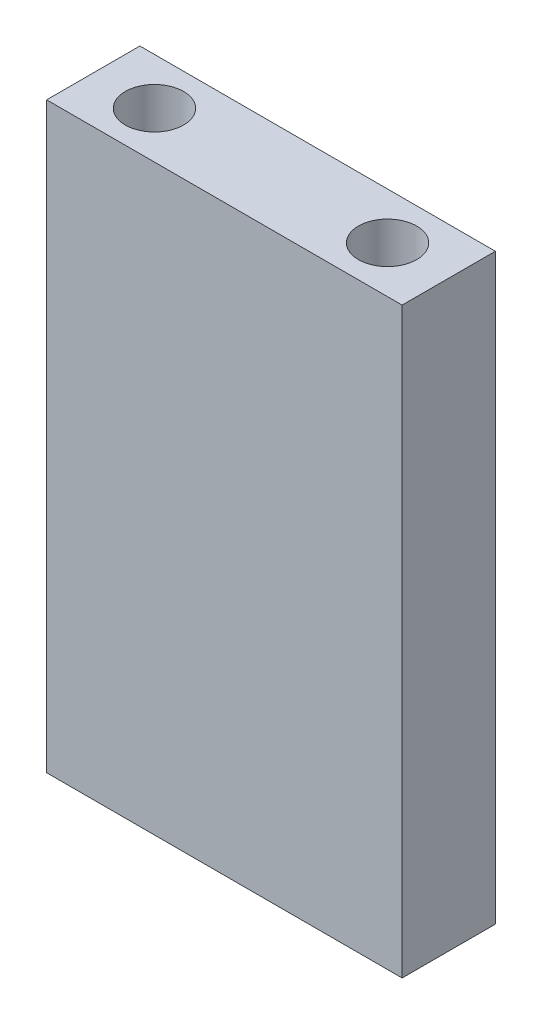
from build123d import *

# Parameters (mm, degrees)
SKETCH1_W           = 15.25
SKETCH1_H           = 25
BOSS_EXTRUDE1_DEPTH = 2
SKETCH3_R           = 1.25
CUT_EXTRUDE1_DEPTH  = 4


with BuildPart() as part:
    # Sketch1 → Boss-Extrude1 (new, symmetric)
    with BuildSketch(Plane.XY):
        Rectangle(SKETCH1_W, SKETCH1_H)
    extrude(amount=BOSS_EXTRUDE1_DEPTH, both=True)

    # Sketch3 → Cut-Extrude1 (cut)
    with BuildSketch(Plane(origin=(0, 12.5, 0), x_dir=(1, 0, 0), z_dir=(0, 1, 0))):
        with Locations(Location((-5, 0, 0), (0, 0, 270))):
            Circle(SKETCH3_R)
        with Locations(Location((5, 0, 0), (0, 0, 270))):
            Circle(SKETCH3_R)
    extrude(amount=-CUT_EXTRUDE1_DEPTH, mode=Mode.SUBTRACT)


solid = part.part
